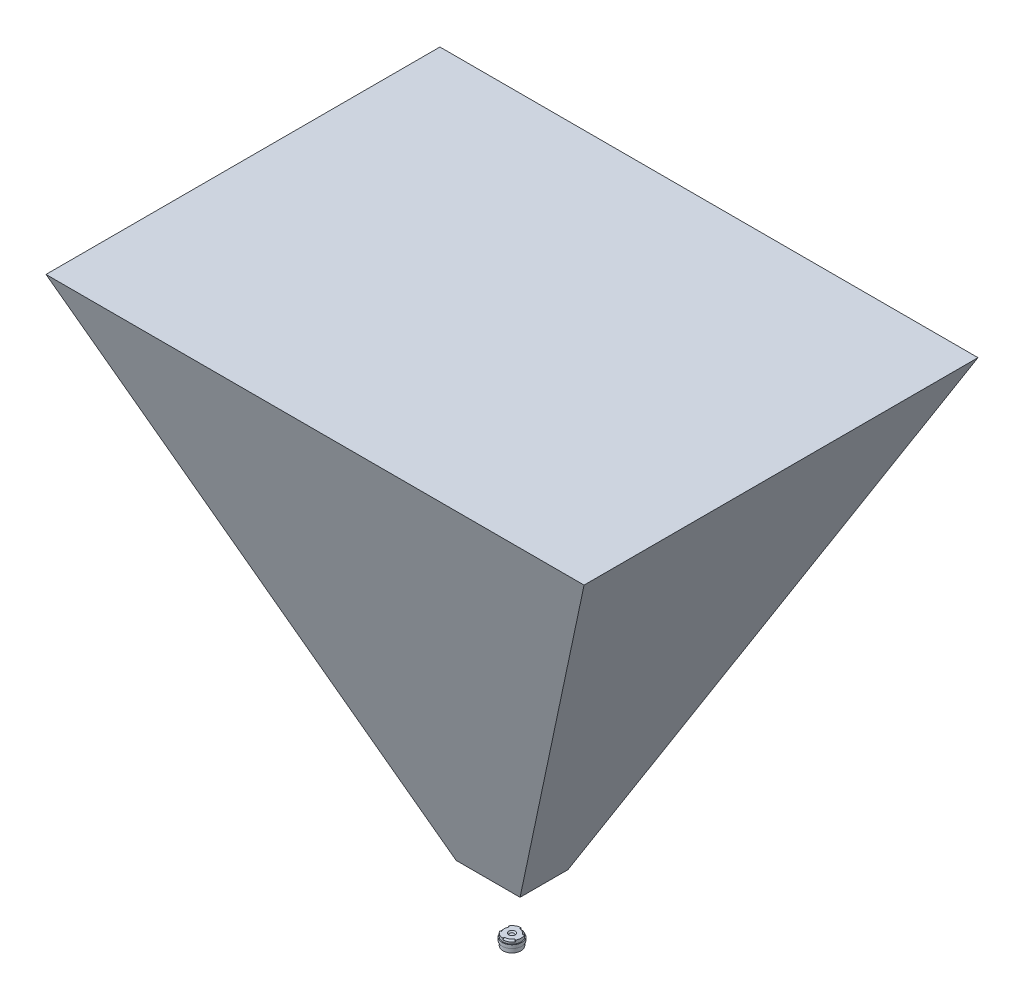
from build123d import *

# Parameters (mm, degrees)
SKIZZE4_W             = 0.25
SKIZZE4_H             = 1
TOOLFACE_ANGLE        = 60
KREISMUSTER1_COUNT    = 3
FOV_3_6MM_F_2_9_DEPTH = 100
FOV2_DEPTH            = 201.874885093
FOV2_DEPTH_BACK       = 201.874885093
SKIZZE8_OUTSIDE_W     = 259.268
SKIZZE8_OUTSIDE_H     = 225.374
SKIZZE8_OUTSIDE_R     = 5


with BuildPart() as part:
    # Skizze3 → Body (revolve)
    with BuildSketch(Plane.XY, mode=Mode.PRIVATE) as body_sk:
        with BuildLine():
            Line((1, 0.8), (2.75, 0.8))
            Line((2.75, 0.8), (2.75, -2.55))
            Line((2.75, -2.55), (2.1, -2.55))
            Line((2.1, -2.55), (1.8, -2.25))
            ThreePointArc((1.8, -2.25), (0.91241438, -2.474486277), (0, -2.55))
            Line((0, -2.55), (0, 0.525))
            ThreePointArc((0, 0.525), (0.316474723, 0.499842016), (0.625, 0.425))
            Line((0.625, 0.425), (1, 0.8))
        make_face()
    revolve(body_sk.sketch.rotate(Axis((0, 0, 0), (0, -1, 0)), 90), axis=Axis((0, 0, 0), (0, -1, 0)))

    # Skizze4 → Thread (revolve)
    with BuildSketch(Plane.XY):
        with Locations((2.875, -0.7)):
            Rectangle(SKIZZE4_W, SKIZZE4_H)
    revolve(axis=Axis((0, 0, 0), (0, 1, 0)))

    # Skizze5 → Toolface (revolve, cut)
    with BuildSketch(Plane(origin=(0, 0, 0), x_dir=(0, 0, -1), z_dir=(1, 0, 0))):
        Polygon((2.75, 0.8), (2.75, 0.35), (2.3, 0.8), align=None)
    toolface = revolve(axis=Axis((0, 0, 0), (0, -1, 0)), revolution_arc=TOOLFACE_ANGLE, mode=Mode.SUBTRACT)

    # Kreismuster1: Toolface ×3 about axis
    kreismuster1_axis = Axis((0, 0, 0), (0, 1, 0))
    for i in range(1, KREISMUSTER1_COUNT):
        add(toolface.rotate(kreismuster1_axis, i * 360 / KREISMUSTER1_COUNT), mode=Mode.SUBTRACT)


with BuildPart() as body_2:
    # Skizze6 → FOV - 3,6mm f/2,9 (new, symmetric)
    with BuildSketch(Plane(origin=(0, 0, 0), x_dir=(0, 0, -1), z_dir=(1, 0, 0))):
        Polygon((-7.279404685, 18.707826613), (-60, 163.55647178), (60, 163.55647178), (7.279404685, 18.707826613), align=None)
    extrude(amount=FOV_3_6MM_F_2_9_DEPTH, both=True)

    # Skizze8 outside → FOV2 (cut, two sides: drawn at the far end of the back side and taken through both)
    with BuildSketch(Plane.XY.offset(-FOV2_DEPTH_BACK)):
        with Locations((0, 80.503)):
            Rectangle(SKIZZE8_OUTSIDE_W, SKIZZE8_OUTSIDE_H)
        Circle(SKIZZE8_OUTSIDE_R, mode=Mode.SUBTRACT)
        Polygon((-9.740481092, 18.707826613), (-81.959351524, 163.55647178), (81.959351524, 163.55647178), (9.740481092, 18.707826613), align=None, mode=Mode.SUBTRACT)
    extrude(amount=FOV2_DEPTH + FOV2_DEPTH_BACK, mode=Mode.SUBTRACT)


solid = Compound([part.part, body_2.part])
